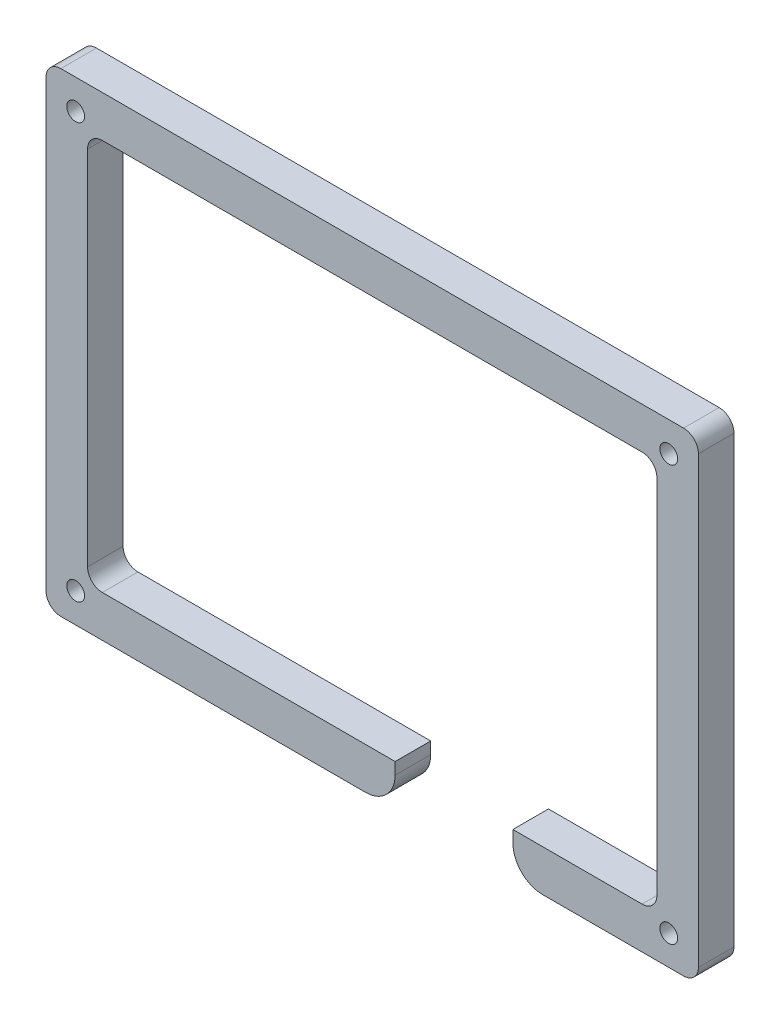
from build123d import *

# Parameters (mm, degrees)
SKETCH2_W               = 110
SKETCH2_H               = 80
SKETCH2_W_2             = 96
SKETCH2_H_2             = 66
BOSS_EXTRUDE2_DEPTH     = 6
FILLET1_R               = 2.5
SKETCH3_R               = 1.5
CUT_EXTRUDE1_DEPTH      = 136.876166867
FILLET2_R               = 2.5
CUT_EXTRUDE2_DEPTH      = 136.876166867
CUT_EXTRUDE2_DEPTH_BACK = 136.876166867
FILLET3_R               = 5


with BuildPart() as part:
    # Sketch2 → Boss-Extrude2 (new body)
    with BuildSketch(Plane.XY):
        with Locations((-54.66463752, 40)):
            Rectangle(SKETCH2_W, SKETCH2_H)
        with Locations((-54.66463752, 40)):
            Rectangle(SKETCH2_W_2, SKETCH2_H_2, mode=Mode.SUBTRACT)
    extrude(amount=BOSS_EXTRUDE2_DEPTH)

    # Fillet1
    fillet1_edges = [part.edges().sort_by_distance(p)[0] for p in [
        (-6.66463752, 7, 3),
        (-6.66463752, 73, 3),
        (-102.66463752, 73, 3),
        (-102.66463752, 7, 3),
    ]]
    fillet(fillet1_edges, radius=FILLET1_R)

    # Sketch3 → Cut-Extrude1 (cut, through all)
    with BuildSketch(Plane.XY.offset(6)):
        with Locations((-4.66463752, 75)):
            Circle(SKETCH3_R)
        with Locations((-4.66463752, 5)):
            Circle(SKETCH3_R)
        with Locations((-104.66463752, 5)):
            Circle(SKETCH3_R)
        with Locations((-104.66463752, 75)):
            Circle(SKETCH3_R)
    extrude(amount=-CUT_EXTRUDE1_DEPTH, mode=Mode.SUBTRACT)

    # Fillet2
    fillet2_edges = [part.edges().sort_by_distance(p)[0] for p in [
        (0.33536248, 0, 3),
        (-109.66463752, 0, 3),
        (-109.66463752, 80, 3),
        (0.33536248, 80, 3),
    ]]
    fillet(fillet2_edges, radius=FILLET2_R)

    # Sketch4 → Cut-Extrude2 (cut, two sides: drawn at the far end of the back side and taken through both)
    with BuildSketch(Plane(origin=(0, 0, 0), x_dir=(-1, 0, 0), z_dir=(0, 0, -1)).offset(-CUT_EXTRUDE2_DEPTH_BACK)):
        Polygon((29.236938862, -234.527844878), (30.900112939, 0), (30.949754032, 7), (50.799101604, 7), (50.799101604, 0), (50.799101604, -234.533742073), (50.670812865, -703.601208677), (29.108650122, -703.595311481), align=None)
    extrude(amount=CUT_EXTRUDE2_DEPTH + CUT_EXTRUDE2_DEPTH_BACK, mode=Mode.SUBTRACT)

    # Fillet3
    fillet3_edges = [part.edges().sort_by_distance(p)[0] for p in [
        (-30.900112939, 0, 3),
        (-50.799101604, 0, 3),
    ]]
    fillet(fillet3_edges, radius=FILLET3_R)


solid = part.part
